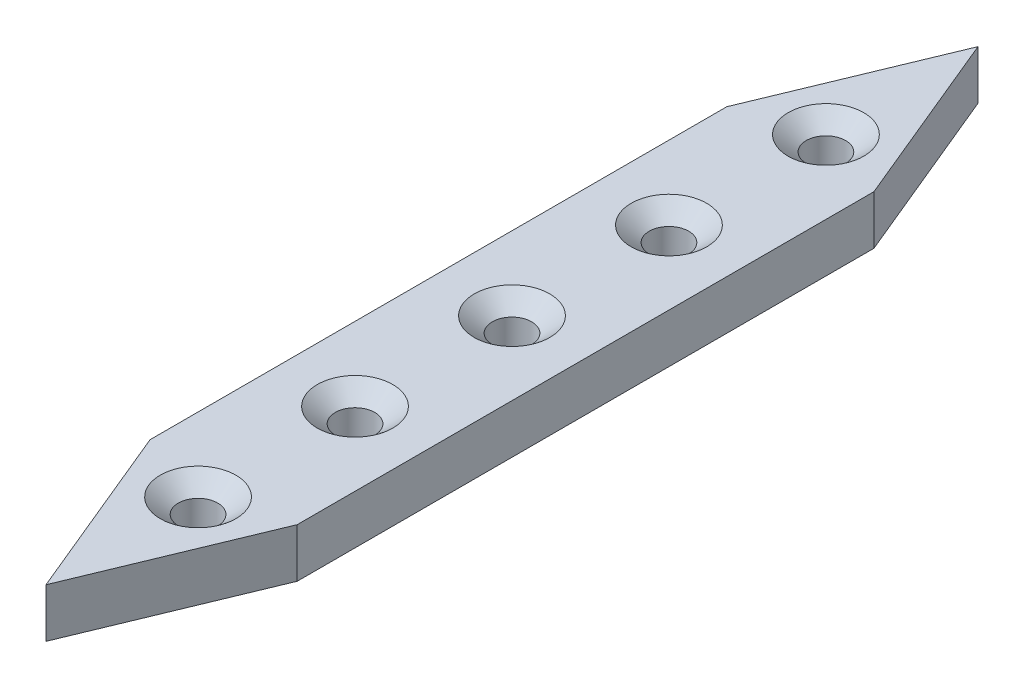
from build123d import *

# Parameters (mm, degrees)
BOSS_EXTRUDE1_DEPTH                                = 6.35
CSK_FOR_10_FLAT_HEAD_MACHINE_SCREW_100_D           = 5.1054
CSK_FOR_10_FLAT_HEAD_MACHINE_SCREW_100_CSINK_D     = 9.779
CSK_FOR_10_FLAT_HEAD_MACHINE_SCREW_100_CSINK_ANGLE = 100


with BuildPart() as part:
    # Sketch1 → Boss-Extrude1 (new body)
    with BuildSketch(Plane(origin=(0, 0, 0), x_dir=(1, 0, 0), z_dir=(0, 1, 0))):
        Polygon((0, 60.325), (-9.525, 37.329615818), (-9.525, -37.329615818), (0, -60.325), (9.525, -37.329615818), (9.525, 37.329615818), align=None)
    extrude(amount=BOSS_EXTRUDE1_DEPTH)

    # CSK for #10 Flat Head Machine Screw (100)1 (through all)
    with Locations(Plane(origin=(0, 6.35, 0), x_dir=(1, 0, 0), z_dir=(0, 1, 0))):
        with Locations((0, 20.32), (0, 40.64), (0, 0), (0, -20.32), (0, -40.64)):
            CounterSinkHole(CSK_FOR_10_FLAT_HEAD_MACHINE_SCREW_100_D / 2, CSK_FOR_10_FLAT_HEAD_MACHINE_SCREW_100_CSINK_D / 2, counter_sink_angle=CSK_FOR_10_FLAT_HEAD_MACHINE_SCREW_100_CSINK_ANGLE)


solid = part.part
